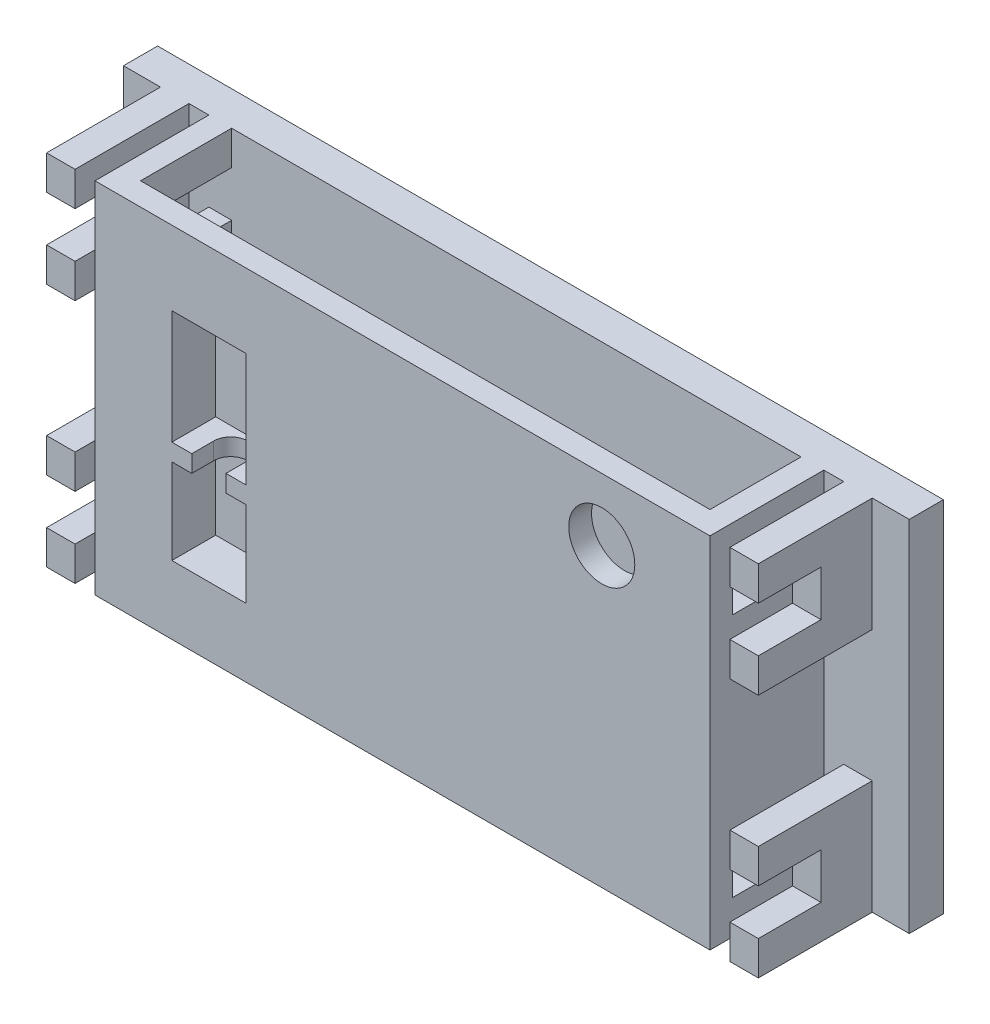
from build123d import *

# Parameters (mm, degrees)
ESBO_O1_W                = 69
ESBO_O1_H                = 31.5
RESSALTO_EXTRUS_O1_DEPTH = 6
ESBO_O2_W                = 5
ESBO_O2_H                = 20
RESSALTO_EXTRUS_O2_DEPTH = 20
ESBO_O3_W                = 5
ESBO_O3_H                = 8
CORTE_EXTRUS_O1_DEPTH    = 11
ESBO_O4_W                = 4
ESBO_O4_H                = 31.5
RESSALTO_EXTRUS_O3_DEPTH = 20
ESBO_O5_W                = 16
ESBO_O5_H                = 8
CORTE_EXTRUS_O2_DEPTH    = 4
ESBO_O6_W                = 4
ESBO_O6_H                = 31.5
RESSALTO_EXTRUS_O4_DEPTH = 50
ESBO_O18_R               = 3.8
CORTE_EXTRUS_O3_DEPTH    = 4
ESBO_O19_R               = 5.8
CORTE_EXTRUS_O5_DEPTH    = 4
ESBO_O20_W               = 20
ESBO_O20_H               = 45
RESSALTO_EXTRUS_O9_DEPTH = 7
ESBO_O21_W               = 13
ESBO_O21_H               = 15
CORTE_EXTRUS_O6_DEPTH    = 7.7
ESBO_O22_W               = 13
ESBO_O22_H               = 20
CORTE_EXTRUS_O7_DEPTH    = 7.7
CORTE_EXTRUS_O9_DEPTH    = 3


with BuildPart() as part:
    # Esboço1 → Ressalto-extrusão1 (new body)
    with BuildSketch(Plane.XY):
        with Locations((-34.5, -15.931977108)):
            Rectangle(ESBO_O1_W, ESBO_O1_H)
    extrude(amount=RESSALTO_EXTRUS_O1_DEPTH)

    # Esboço2 → Ressalto-extrusão2 (add)
    with BuildSketch(Plane.XY.offset(6)):
        with Locations((-60, -21.681977108)):
            Rectangle(ESBO_O2_W, ESBO_O2_H)
    extrude(amount=RESSALTO_EXTRUS_O2_DEPTH)

    # Esboço3 → Corte-extrusão1 (cut)
    with BuildSketch(Plane.XY.offset(26)):
        with Locations((-60, -21.681977108)):
            Rectangle(ESBO_O3_W, ESBO_O3_H)
    extrude(amount=-CORTE_EXTRUS_O1_DEPTH, mode=Mode.SUBTRACT)

    # Esboço4 → Ressalto-extrusão3 (add)
    with BuildSketch(Plane.XY.offset(6)):
        with Locations((-52, -15.931977108)):
            Rectangle(ESBO_O4_W, ESBO_O4_H)
    extrude(amount=RESSALTO_EXTRUS_O3_DEPTH)

    # Esboço5 → Corte-extrusão2 (cut)
    with BuildSketch(Plane(origin=(-50, 0, 0), x_dir=(0, 0, -1), z_dir=(1, 0, 0))):
        with Locations((-14, -21.681977108)):
            Rectangle(ESBO_O5_W, ESBO_O5_H)
    extrude(amount=-CORTE_EXTRUS_O2_DEPTH, mode=Mode.SUBTRACT)

    # Esboço6 → Ressalto-extrusão4 (add)
    with BuildSketch(Plane(origin=(-50, 0, 0), x_dir=(0, 0, -1), z_dir=(1, 0, 0))):
        with Locations((-24, -15.931977108)):
            Rectangle(ESBO_O6_W, ESBO_O6_H)
    extrude(amount=RESSALTO_EXTRUS_O4_DEPTH)

    # Espelhar10: part across plane


with BuildPart() as part_1:
    add(part.part)
    add(part.part.mirror(Plane.ZX.offset(-0.181977108)))

    # Espelhar11: part across plane


with BuildPart() as part_2:
    add(part_1.part)
    add(part_1.part.mirror(Plane(origin=(0, 0, 0), x_dir=(0, 0, 1), z_dir=(1, 0, 0))))

    # Esboço18 → Corte-extrusão3 (cut)
    with BuildSketch(Plane.ZY.offset(54)):
        with Locations((16, -0.181977108)):
            Circle(ESBO_O18_R)
    extrude(amount=-CORTE_EXTRUS_O3_DEPTH, mode=Mode.SUBTRACT)

    # Esboço19 → Corte-extrusão5 (cut)
    with BuildSketch(Plane.XY.offset(26)):
        with Locations((35, 20.318022892)):
            Circle(ESBO_O19_R)
    extrude(amount=-CORTE_EXTRUS_O5_DEPTH, mode=Mode.SUBTRACT)

    # Esboço20 → Ressalto-extrusão9 (add)
    with BuildSketch(Plane(origin=(0, 0, 22), x_dir=(-1, 0, 0), z_dir=(0, 0, -1))):
        with Locations((34, -0.181977108)):
            Rectangle(ESBO_O20_W, ESBO_O20_H)
    extrude(amount=RESSALTO_EXTRUS_O9_DEPTH)

    # Esboço21 → Corte-extrusão6 (cut)
    with BuildSketch(Plane.XY.offset(26)):
        with Locations((-34, -12.181977108)):
            Rectangle(ESBO_O21_W, ESBO_O21_H)
    extrude(amount=-CORTE_EXTRUS_O6_DEPTH, mode=Mode.SUBTRACT)

    # Esboço22 → Corte-extrusão7 (cut)
    with BuildSketch(Plane.XY.offset(26)):
        with Locations((-34, 8.318022892)):
            Rectangle(ESBO_O22_W, ESBO_O22_H)
    extrude(amount=-CORTE_EXTRUS_O7_DEPTH, mode=Mode.SUBTRACT)

    # Esboço23 → Corte-extrusão9 (cut)
    with BuildSketch(Plane(origin=(0, -1.681977108, 0), x_dir=(1, 0, 0), z_dir=(0, 1, 0))):
        with BuildLine():
            Line((-31, -26), (-31, -22.15))
            ThreePointArc((-31, -22.15), (-34, -19.15), (-37, -22.15))
            Line((-37, -22.15), (-37, -26))
            Line((-37, -26), (-31, -26))
        make_face()
    extrude(amount=-CORTE_EXTRUS_O9_DEPTH, mode=Mode.SUBTRACT)


solid = part_2.part
